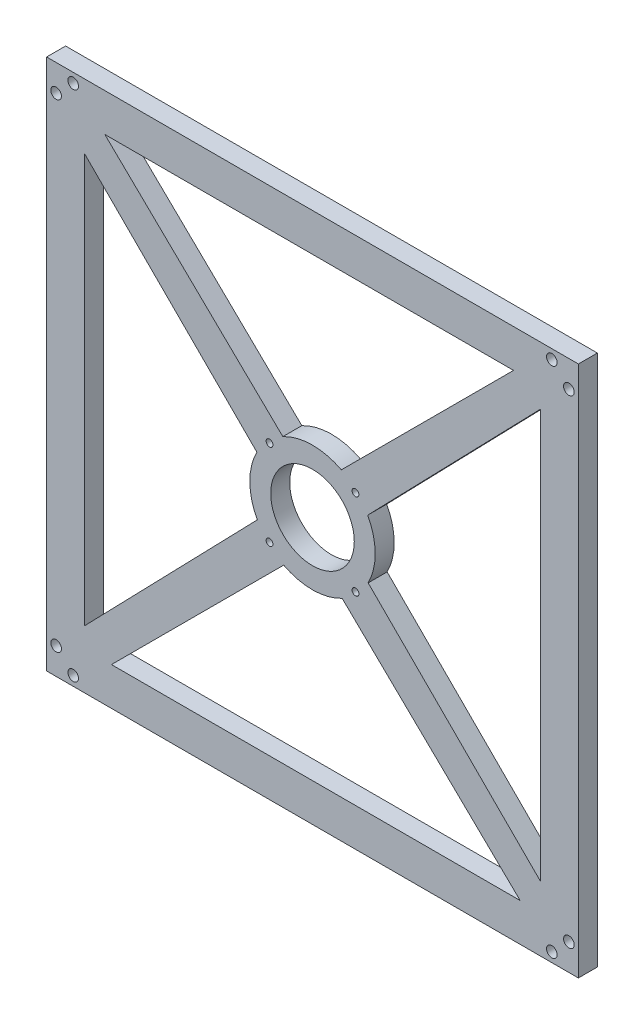
from build123d import *

# Parameters (mm, degrees)
SKETCH3_W           = 140
SKETCH3_H           = 140
BOSS_EXTRUDE1_DEPTH = 5
CUT_EXTRUDE1_DEPTH  = 5
CIRPATTERN1_COUNT   = 4
CUT_EXTRUDE2_REACH  = 101.121
SKETCH7_R           = 11
CIRPATTERN2_COUNT   = 4
CIRPATTERN3_COUNT   = 4


with BuildPart() as part:
    # Sketch3 → Boss-Extrude1 (new body)
    with BuildSketch(Plane.XY):
        Rectangle(SKETCH3_W, SKETCH3_H)
    extrude(amount=BOSS_EXTRUDE1_DEPTH)

    # Sketch4 → Cut-Extrude1 (cut)
    with BuildSketch(Plane.XY.offset(5)):
        with BuildLine():
            Line((7.583144073, 14.654211885), (52.928932188, 60))
            Line((52.928932188, 60), (-54.688394727, 60))
            Line((-54.688394727, 60), (-7.80758307, 14.53587447))
            ThreePointArc((-7.80758307, 14.53587447), (-0.126862728, 16.499512291), (7.583144073, 14.654211885))
        make_face()
    cut_extrude1 = extrude(amount=-CUT_EXTRUDE1_DEPTH, mode=Mode.SUBTRACT)

    # CirPattern1: Cut-Extrude1 ×4 about axis
    cirpattern1_axis = Axis((0, 0, 5), (0, 0, -1))
    for i in range(1, CIRPATTERN1_COUNT):
        add(cut_extrude1.rotate(cirpattern1_axis, i * 360 / CIRPATTERN1_COUNT), mode=Mode.SUBTRACT)

    # Sketch7 → Cut-Extrude2 (cut, up to next)
    with BuildSketch(Plane.XY.offset(5), mode=Mode.PRIVATE) as cut_extrude2_sk1:
        Circle(SKETCH7_R)
    cut_extrude2_tool1 = extrude(cut_extrude2_sk1.sketch, amount=-CUT_EXTRUDE2_REACH, mode=Mode.PRIVATE) & part.part
    add(cut_extrude2_tool1.solids().sort_by_distance((0, 0, 5))[0], mode=Mode.SUBTRACT)

    # Sketch9 → Ø1.8 (1.8) Diameter Hole1 (revolve, cut)
    with BuildSketch(Plane(origin=(11.313708499, -11.313708499, 5), x_dir=(0, -1, 0), z_dir=(1, 0, 0))):
        Polygon((0, 0), (0, 6.540774557), (0.9, 6), (0.9, 0), align=None)
    f_1_8_1_8_diameter_hole1 = revolve(axis=Axis((11.313708499, -11.313708499, 11.35), (0, 0, -1)), mode=Mode.SUBTRACT)

    # CirPattern2: Ø1.8 (1.8) Diameter Hole1 ×4 about axis
    cirpattern2_axis = Axis((0, 0, 0), (0, 0, 1))
    for i in range(1, CIRPATTERN2_COUNT):
        add(f_1_8_1_8_diameter_hole1.rotate(cirpattern2_axis, i * 360 / CIRPATTERN2_COUNT), mode=Mode.SUBTRACT)

    # Sketch10 → Ø3.0mm Dowel Hole1 (revolve, cut)
    with BuildSketch(Plane(origin=(67.5, -63, 0), x_dir=(0, 1, 0), z_dir=(1, 0, 0))):
        Polygon((0, 0), (0, 10.841204867), (1.4, 10), (1.4, 0), align=None)
    f_3_0mm_dowel_hole1 = revolve(axis=Axis((67.5, -63, -6.35), (0, 0, 1)), mode=Mode.SUBTRACT)

    # Sketch11 → Ø3.0mm Dowel Hole2 (revolve, cut)
    with BuildSketch(Plane(origin=(63, -67.5, 5), x_dir=(0, -1, 0), z_dir=(1, 0, 0))):
        Polygon((0, 0), (0, 10.841204867), (1.4, 10), (1.4, 0), align=None)
    f_3_0mm_dowel_hole2 = revolve(axis=Axis((63, -67.5, 11.35), (0, 0, -1)), mode=Mode.SUBTRACT)

    # CirPattern3: Ø3.0mm Dowel Hole1, Ø3.0mm Dowel Hole2 ×4 about axis
    cirpattern3_axis = Axis((0, 0, 5.25), (0, 0, -1))
    add([f_3_0mm_dowel_hole1.rotate(cirpattern3_axis, i * 360 / CIRPATTERN3_COUNT) for i in range(1, CIRPATTERN3_COUNT)], mode=Mode.SUBTRACT)
    add([f_3_0mm_dowel_hole2.rotate(cirpattern3_axis, i * 360 / CIRPATTERN3_COUNT) for i in range(1, CIRPATTERN3_COUNT)], mode=Mode.SUBTRACT)


solid = part.part
